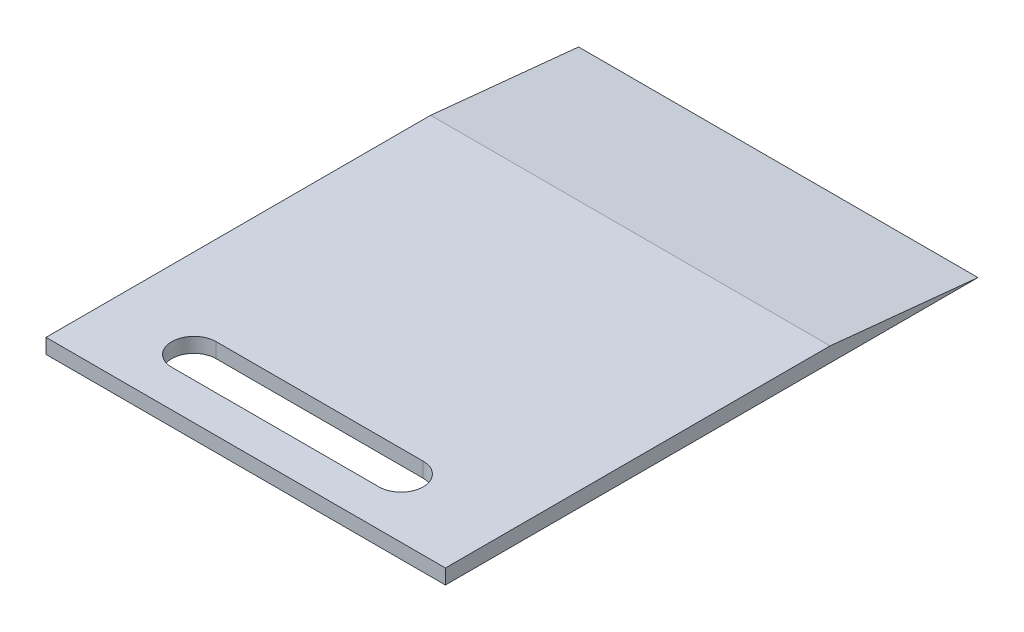
from build123d import *

# Parameters (mm, degrees)
SALIENTE_EXTRUIR1_DEPTH = 13.5
CORTAR_EXTRUIR1_DEPTH   = 23.50555487


with BuildPart() as part:
    # Croquis1 → Saliente-Extruir1 (new body)
    with BuildSketch(Plane(origin=(0, 0, 0), x_dir=(0, 0, -1), z_dir=(1, 0, 0))):
        Polygon((0, 0), (18, 0), (13, 0.5), (0, 0.5), align=None)
    extrude(amount=SALIENTE_EXTRUIR1_DEPTH)

    # Croquis2 → Cortar-Extruir1 (cut, through all)
    with BuildSketch(Plane(origin=(0, 0.5, 0), x_dir=(1, 0, 0), z_dir=(0, 1, 0))):
        with BuildLine():
            Line((3, 2.75), (10, 2.75))
            ThreePointArc((10, 2.75), (10.75, 2), (10, 1.25))
            Line((10, 1.25), (3, 1.25))
            ThreePointArc((3, 1.25), (2.25, 2), (3, 2.75))
        make_face()
    extrude(amount=-CORTAR_EXTRUIR1_DEPTH, mode=Mode.SUBTRACT)


solid = part.part
